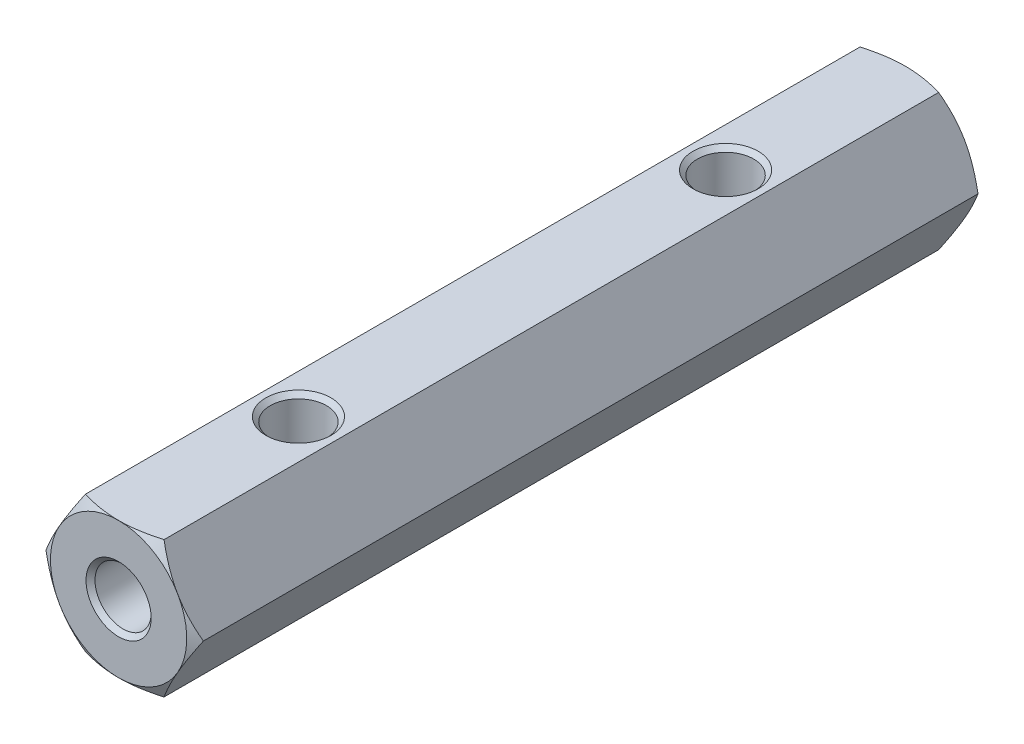
from build123d import *

# Parameters (mm, degrees)
EXTRUDE_1_DEPTH          = 17.5
SKETCH_2_OUTSIDE_W       = 142.004
SKETCH_2_OUTSIDE_H       = 141.066
SKETCH_2_OUTSIDE_R       = 3.031088913
CUT_EXTRUDE_1_DEPTH      = 36.304921753
CUT_EXTRUDE_1_DRAFT      = -60
HOLE_WIZARD_M3_1_D       = 2.5
HOLE_WIZARD_M3_2_D       = 2.5
MIRROR_1_COPY_1_SKETCH_W = 142.004
MIRROR_1_COPY_1_SKETCH_H = 141.066
MIRROR_1_COPY_1_SKETCH_R = 3.031088913
MIRROR_1_COPY_1_DEPTH    = 36.304921753
MIRROR_1_COPY_1_DRAFT    = -60
CHAMFER_1_SIZE           = 0.2


with BuildPart() as part:
    # 草图1 → 凸台-拉伸1 (new, symmetric)
    with BuildSketch(Plane.XY):
        Polygon((3.5, 0), (1.75, 3.031088913), (-1.75, 3.031088913), (-3.5, 0), (-1.75, -3.031088913), (1.75, -3.031088913), align=None)
    extrude(amount=EXTRUDE_1_DEPTH, both=True)


with BuildPart() as cut_extrude_1_tool:
    # 草图2 outside → 切除-拉伸1 (with draft: the straight prism first)
    with BuildSketch(Plane.XY.offset(17.5)):
        Rectangle(SKETCH_2_OUTSIDE_W, SKETCH_2_OUTSIDE_H)
        Circle(SKETCH_2_OUTSIDE_R, mode=Mode.SUBTRACT)
    extrude(amount=-CUT_EXTRUDE_1_DEPTH)
    # 切除-拉伸1: the draft: its side faces are tilted about the plane it starts from
    cut_extrude_1_sides = [cut_extrude_1_tool.faces().sort_by_distance(p)[0] for p in [
        (0, -70.533, -0.652460877),
        (71.002, 0, -0.652460877),
        (0, 70.533, -0.652460877),
        (-71.002, 0, -0.652460877),
        (-3.031088913, 0, -0.652460877),
    ]]
    draft(cut_extrude_1_sides, Plane.XY.offset(17.5), CUT_EXTRUDE_1_DRAFT)


with BuildPart() as part_1:
    add(part.part)

    # 切除-拉伸1: cut by cut_extrude_1_tool
    add(cut_extrude_1_tool.part, mode=Mode.SUBTRACT)

    # M3 螺纹孔1 (through all)
    with Locations(Plane.XY.offset(17.5)):
        with Locations((0, 0)):
            hole_wizard_m3_1 = Hole(HOLE_WIZARD_M3_1_D / 2)

    # M3 螺纹孔2 (through all)
    with Locations(Plane(origin=(0, 3.031088913, 0), x_dir=(1, 0, 0), z_dir=(0, 1, 0))):
        with Locations((0, -9.5)):
            hole_wizard_m3_2 = Hole(HOLE_WIZARD_M3_2_D / 2)

    # 镜向1: M3 螺纹孔1, M3 螺纹孔2 across plane
    add(hole_wizard_m3_1.mirror(Plane.XY), mode=Mode.SUBTRACT)
    add(hole_wizard_m3_2.mirror(Plane.XY), mode=Mode.SUBTRACT)


with BuildPart() as mirror_1_copy_1_tool:
    # 镜向1 copy 1 sketch → 镜向1 copy 1 (with draft: the straight prism first)
    with BuildSketch(Plane(origin=(0, 0, -17.5), x_dir=(1, 0, 0), z_dir=(0, 0, -1))):
        Rectangle(MIRROR_1_COPY_1_SKETCH_W, MIRROR_1_COPY_1_SKETCH_H)
        Circle(MIRROR_1_COPY_1_SKETCH_R, mode=Mode.SUBTRACT)
    extrude(amount=-MIRROR_1_COPY_1_DEPTH)
    # 镜向1 copy 1: the draft: its side faces are tilted about the plane it starts from
    mirror_1_copy_1_sides = [mirror_1_copy_1_tool.faces().sort_by_distance(p)[0] for p in [
        (0, -70.533, 0.652460877),
        (71.002, 0, 0.652460877),
        (0, 70.533, 0.652460877),
        (-71.002, 0, 0.652460877),
        (-3.031088913, 0, 0.652460877),
    ]]
    draft(mirror_1_copy_1_sides, Plane(origin=(0, 0, -17.5), x_dir=(1, 0, 0), z_dir=(0, 0, -1)), MIRROR_1_COPY_1_DRAFT)


with BuildPart() as part_2:
    add(part_1.part)

    # 镜向1 copy 1: cut by mirror_1_copy_1_tool
    add(mirror_1_copy_1_tool.part, mode=Mode.SUBTRACT)

    # 倒角1
    chamfer_1_edges = [part_2.edges().sort_by_distance(p)[0] for p in [
        (1.25, -3.031088913, -9.5),
        (1.25, 3.031088913, -9.5),
        (1.25, 0, 17.5),
        (1.25, 0, -17.5),
        (1.25, -3.031088913, 9.5),
        (1.25, 3.031088913, 9.5),
    ]]
    chamfer(chamfer_1_edges, length=CHAMFER_1_SIZE)


solid = part_2.part
